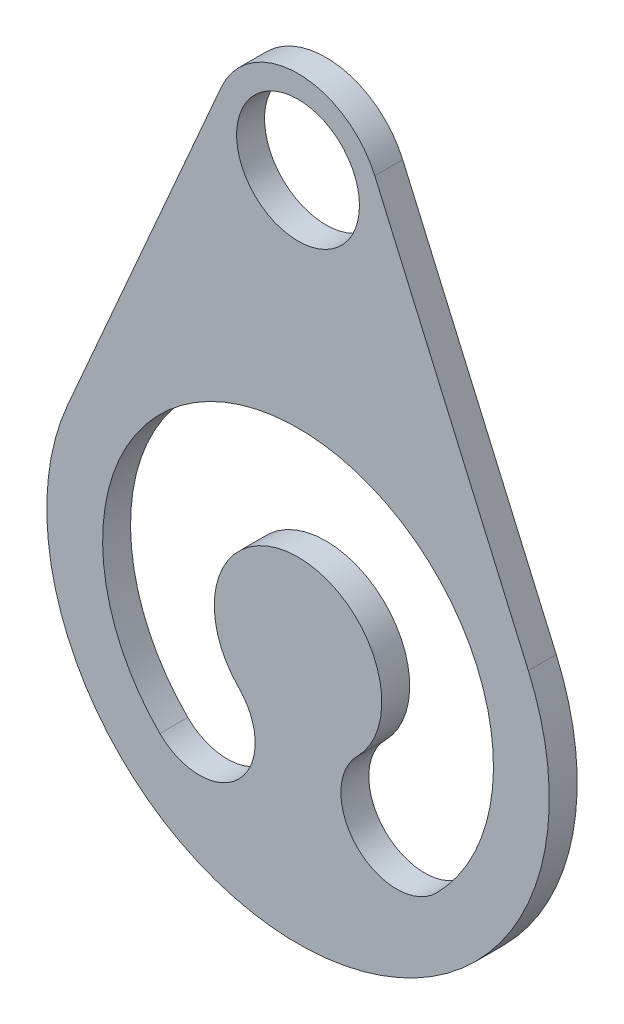
from build123d import *

# Parameters (mm, degrees)
CROQUIS1_R              = 11
SALIENTE_EXTRUIR1_DEPTH = 5


with BuildPart() as part:
    # Croquis1 → Saliente-Extruir1 (new body)
    with BuildSketch(Plane.XY):
        with BuildLine():
            Line((-13.747727085, 81), (-41.243181255, 18))
            ThreePointArc((-41.243181255, 18), (0, -45), (41.243181255, 18))
            Line((41.243181255, 18), (13.747727085, 81))
            ThreePointArc((13.747727085, 81), (0, 90), (-13.747727085, 81))
        make_face()
        with Locations((0, 75)):
            Circle(CROQUIS1_R, mode=Mode.SUBTRACT)
        with BuildLine():
            ThreePointArc((24.748737342, -24.748737342), (0, 35), (-24.748737342, -24.748737342))
            ThreePointArc((-24.748737342, -24.748737342), (-10.606601718, -24.748737342), (-10.606601718, -10.606601718))
            ThreePointArc((-10.606601718, -10.606601718), (0, 15), (10.606601718, -10.606601718))
            ThreePointArc((10.606601718, -10.606601718), (10.606601718, -24.748737342), (24.748737342, -24.748737342))
        make_face(mode=Mode.SUBTRACT)
    extrude(amount=SALIENTE_EXTRUIR1_DEPTH)


solid = part.part
